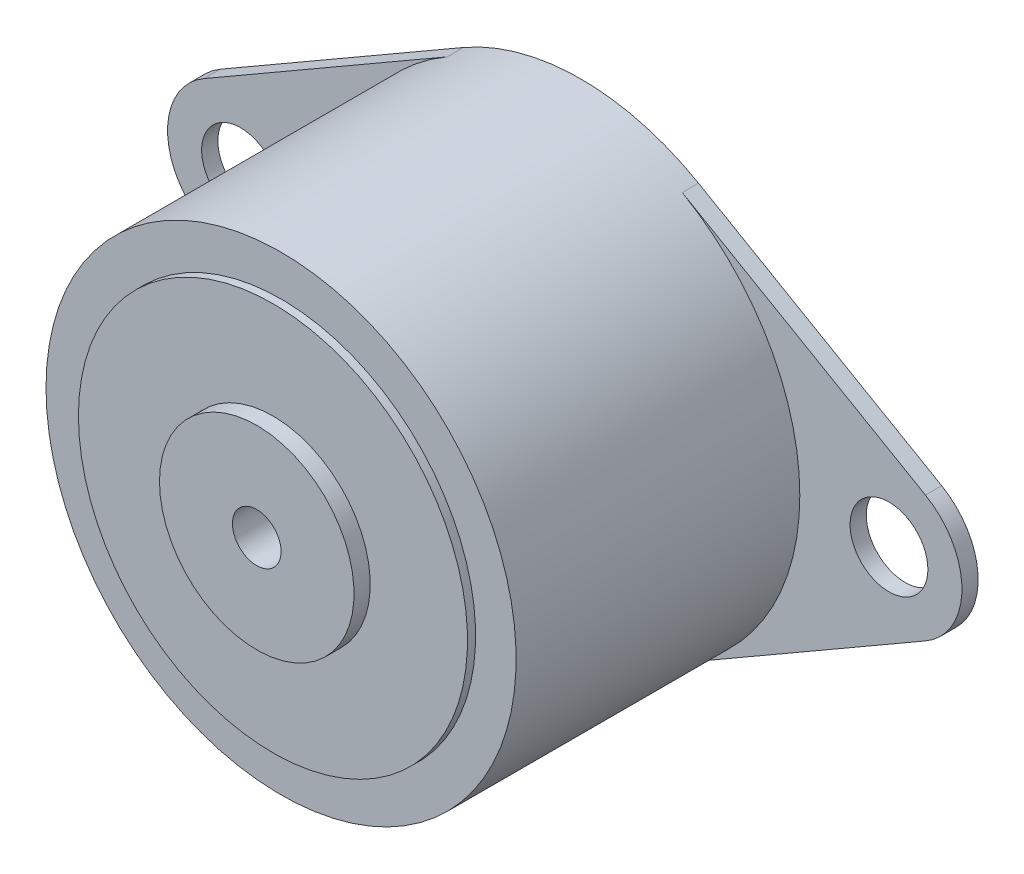
from build123d import *

# Parameters (mm, degrees)
BOSS_EXTRU_1_DEPTH      = 0.5
ESQUISSE2_R             = 7.25
ESQUISSE2_R_2           = 7
BOSS_EXTRU_2_DEPTH      = 8
D_GAGEMENT_M21_D        = 2.4
D_GAGEMENT_M21_DEPTH    = 10
D_GAGEMENT_M21_TIP      = 0.721032743
ESQUISSE16_R            = 7.25
BOSS_EXTRU_4_DEPTH      = 0.75
ESQUISSE7_R             = 0.75
ENL_V_MAT_EXTRU_1_DEPTH = 18.396120257


with BuildPart() as part:
    # Esquisse1 → Boss.-Extru.1 (new body)
    with BuildSketch(Plane.XY):
        with BuildLine():
            Line((-11.125, 1.948557159), (-3.625, 6.278684177))
            ThreePointArc((-3.625, 6.278684177), (0, 7.25), (3.625, 6.278684177))
            Line((3.625, 6.278684177), (11.125, 1.948557159))
            ThreePointArc((11.125, 1.948557159), (12.25, 0), (11.125, -1.948557159))
            Line((11.125, -1.948557159), (3.625, -6.278684177))
            ThreePointArc((3.625, -6.278684177), (0, -7.25), (-3.625, -6.278684177))
            Line((-3.625, -6.278684177), (-11.125, -1.948557159))
            ThreePointArc((-11.125, -1.948557159), (-12.25, 0), (-11.125, 1.948557159))
        make_face()
    extrude(amount=BOSS_EXTRU_1_DEPTH)

    # Esquisse2 → Boss.-Extru.2 (add)
    with BuildSketch(Plane.XY.offset(0.5)):
        with Locations(Location((0, 0, 0), (0, 0, 120))):
            Circle(ESQUISSE2_R)
        Circle(ESQUISSE2_R_2, mode=Mode.SUBTRACT)
    extrude(amount=BOSS_EXTRU_2_DEPTH)

    # Dégagement M21
    with Locations(Plane(origin=(-10, 0, 0.5), x_dir=(1, 0, 0), z_dir=(0, 0, 1))):
        with Locations((0, 0), (20, 0)):
            Hole(D_GAGEMENT_M21_D / 2, depth=D_GAGEMENT_M21_DEPTH)
            with Locations((0, 0, -(D_GAGEMENT_M21_DEPTH + D_GAGEMENT_M21_TIP / 2))):  # 118° drill point
                Cone(0, D_GAGEMENT_M21_D / 2, D_GAGEMENT_M21_TIP, mode=Mode.SUBTRACT)



with BuildPart() as body_2:
    # Esquisse5 → Révolution1 (revolve)
    with BuildSketch(Plane(origin=(0, 0, 0), x_dir=(1, 0, 0), z_dir=(0, 1, 0))):
        Polygon((-6, -9.25), (-6, -9.5), (-3, -9.5), (-3, -10), (-0.75, -10), (-0.75, -9.25), align=None)
    revolve(axis=Axis((0, 0, 0), (0, 0, 1)))


with BuildPart() as part_1:
    add(part.part)

    add(body_2.part)  # Boss.-Extru.4 merges body 2
    # Esquisse16 → Boss.-Extru.4 (add)
    with BuildSketch(Plane.XY.offset(8.5)):
        with Locations(Location((0, 0, 0), (0, 0, 180))):
            Circle(ESQUISSE16_R)
    extrude(amount=BOSS_EXTRU_4_DEPTH)

    # Esquisse7 → Enlèv. mat.-Extru.1 (cut, through all)
    with BuildSketch(Plane(origin=(0, 0, 0), x_dir=(-1, 0, 0), z_dir=(0, 0, -1))):
        Circle(ESQUISSE7_R)
    extrude(amount=-ENL_V_MAT_EXTRU_1_DEPTH, mode=Mode.SUBTRACT)


solid = part_1.part
